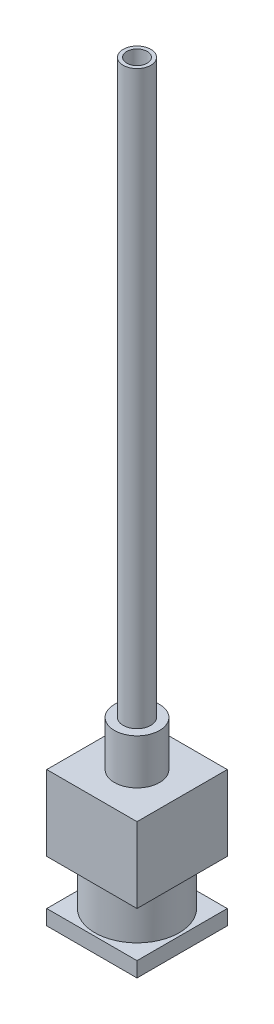
from build123d import *

# Parameters (mm, degrees)
SKETCH1_W               = 6
SKETCH1_H               = 6
BOSS_EXTRUDE1_DEPTH     = 9
SKETCH2_R               = 1.5
BOSS_EXTRUDE2_DEPTH     = 3
CUT_EXTRUDE1_DEPTH      = 13.727922061
CUT_EXTRUDE1_DEPTH_BACK = 13.727922061
SKETCH3_R               = 0.68
BOSS_EXTRUDE3_START     = 38
SKETCH3_3_R             = 0.92
SKETCH3_3_R_2           = 0.68
BOSS_EXTRUDE3_DEPTH     = 38
SKETCH4_R               = 2
CUT_EXTRUDE2_DEPTH      = 8
CUT_EXTRUDE3_START      = -1
SKETCH6_W               = 6
SKETCH6_H               = 6
SKETCH6_R               = 2.8
CUT_EXTRUDE3_DEPTH      = 3


with BuildPart() as part:
    # Sketch1 → Boss-Extrude1 (new body)
    with BuildSketch(Plane(origin=(0, 0, 0), x_dir=(1, 0, 0), z_dir=(0, 1, 0))):
        Rectangle(SKETCH1_W, SKETCH1_H)
    extrude(amount=BOSS_EXTRUDE1_DEPTH)

    # Sketch2 → Boss-Extrude2 (add)
    with BuildSketch(Plane(origin=(0, 9, 0), x_dir=(1, 0, 0), z_dir=(0, 1, 0))):
        with Locations(Location((0, 0, 0), (0, 0, 270))):
            Circle(SKETCH2_R)
    extrude(amount=BOSS_EXTRUDE2_DEPTH)

    # Sketch3 → Cut-Extrude1 (cut, two sides: drawn at the far end of the back side and taken through both)
    with BuildSketch(Plane(origin=(0, 12, 0), x_dir=(1, 0, 0), z_dir=(0, 1, 0)).offset(-CUT_EXTRUDE1_DEPTH_BACK)):
        with Locations(Location((0, 0, 0), (0, 0, 270))):
            Circle(SKETCH3_R)
    extrude(amount=CUT_EXTRUDE1_DEPTH + CUT_EXTRUDE1_DEPTH_BACK, mode=Mode.SUBTRACT)

    # Sketch3<3> → Boss-Extrude3 (add)
    with BuildSketch(Plane(origin=(0, 12, 0), x_dir=(1, 0, 0), z_dir=(0, 1, 0)).offset(BOSS_EXTRUDE3_START)):
        with Locations(Location((0, 0, 0), (0, 0, 270))):
            Circle(SKETCH3_3_R)
        with Locations(Location((0, 0, 0), (0, 0, 270))):
            Circle(SKETCH3_3_R_2, mode=Mode.SUBTRACT)
    extrude(amount=-BOSS_EXTRUDE3_DEPTH)

    # Sketch4 → Cut-Extrude2 (cut)
    with BuildSketch(Plane.XZ):
        with Locations(Location((0, 0, 0), (0, 0, 270))):
            Circle(SKETCH4_R)
    extrude(amount=-CUT_EXTRUDE2_DEPTH, mode=Mode.SUBTRACT)

    # Sketch6 → Cut-Extrude3 (cut)
    with BuildSketch(Plane.XZ.offset(CUT_EXTRUDE3_START)):
        Rectangle(SKETCH6_W, SKETCH6_H)
        with Locations(Location((0, 0, 0), (0, 0, 270))):
            Circle(SKETCH6_R, mode=Mode.SUBTRACT)
    extrude(amount=-CUT_EXTRUDE3_DEPTH, mode=Mode.SUBTRACT)


solid = part.part
